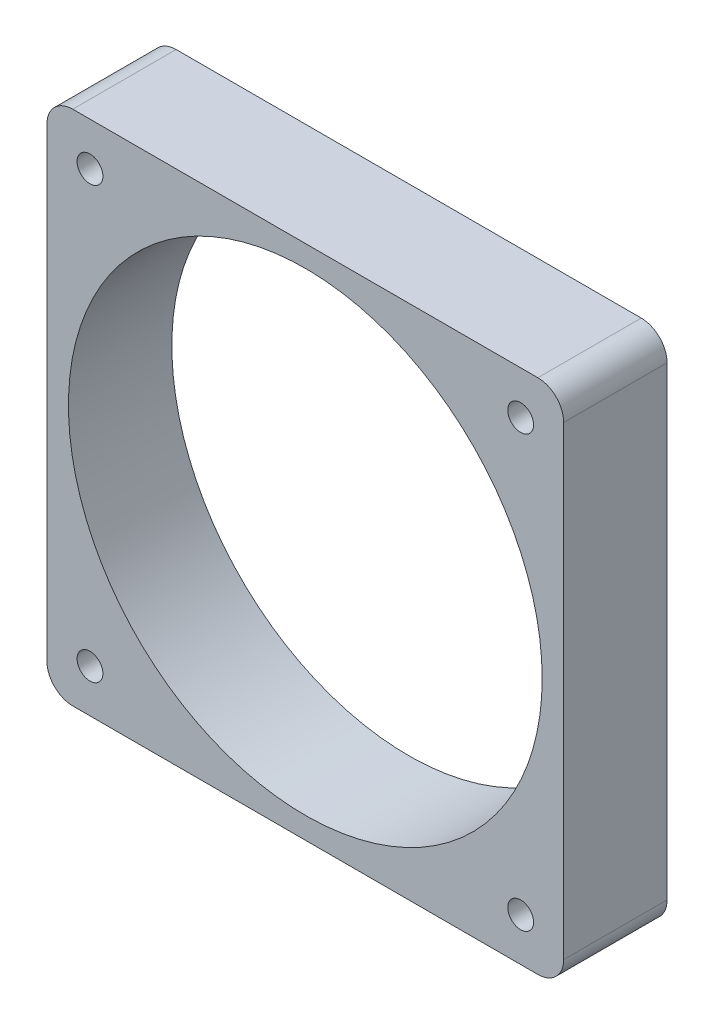
from build123d import *

# Parameters (mm, degrees)
SKETCH1_W           = 60
SKETCH1_H           = 60
SKETCH1_R           = 27.5
SKETCH1_R_2         = 1.5
BOSS_EXTRUDE1_DEPTH = 12
FILLET1_R           = 3


with BuildPart() as part:
    # Sketch1 → Boss-Extrude1 (new body)
    with BuildSketch(Plane.XY):
        with Locations((5.333333333, -8)):
            Rectangle(SKETCH1_W, SKETCH1_H)
        with Locations((5.333333333, -8)):
            Circle(SKETCH1_R, mode=Mode.SUBTRACT)
        with Locations((-19.666666667, 17)):
            Circle(SKETCH1_R_2, mode=Mode.SUBTRACT)
        with Locations((30.333333333, 17)):
            Circle(SKETCH1_R_2, mode=Mode.SUBTRACT)
        with Locations((-19.666666667, -33)):
            Circle(SKETCH1_R_2, mode=Mode.SUBTRACT)
        with Locations((30.333333333, -33)):
            Circle(SKETCH1_R_2, mode=Mode.SUBTRACT)
    extrude(amount=BOSS_EXTRUDE1_DEPTH)

    # Fillet1
    fillet1_edges = [part.edges().sort_by_distance(p)[0] for p in [
        (-24.666666667, 22, 6),
        (35.333333333, 22, 6),
        (35.333333333, -38, 6),
        (-24.666666667, -38, 6),
    ]]
    fillet(fillet1_edges, radius=FILLET1_R)


solid = part.part
